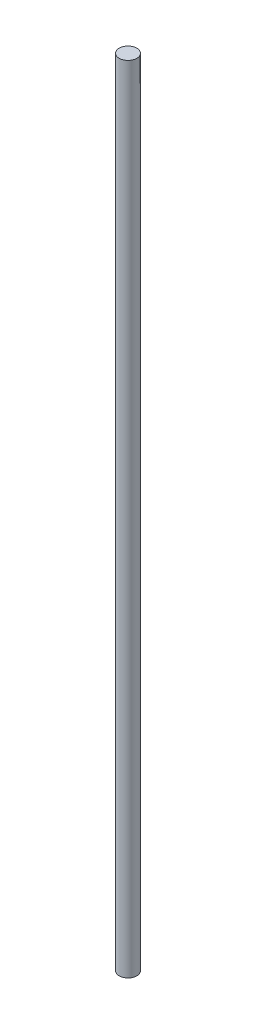
from build123d import *

# Parameters (mm, degrees)
SKETCH1_R           = 4
BOSS_EXTRUDE1_DEPTH = 360


with BuildPart() as part:
    # Sketch1 → Boss-Extrude1 (new body)
    with BuildSketch(Plane(origin=(0, 0, 0), x_dir=(1, 0, 0), z_dir=(0, 1, 0))):
        with Locations(Location((0, 0, 0), (0, 0, 90))):
            Circle(SKETCH1_R)
    extrude(amount=BOSS_EXTRUDE1_DEPTH)


solid = part.part
